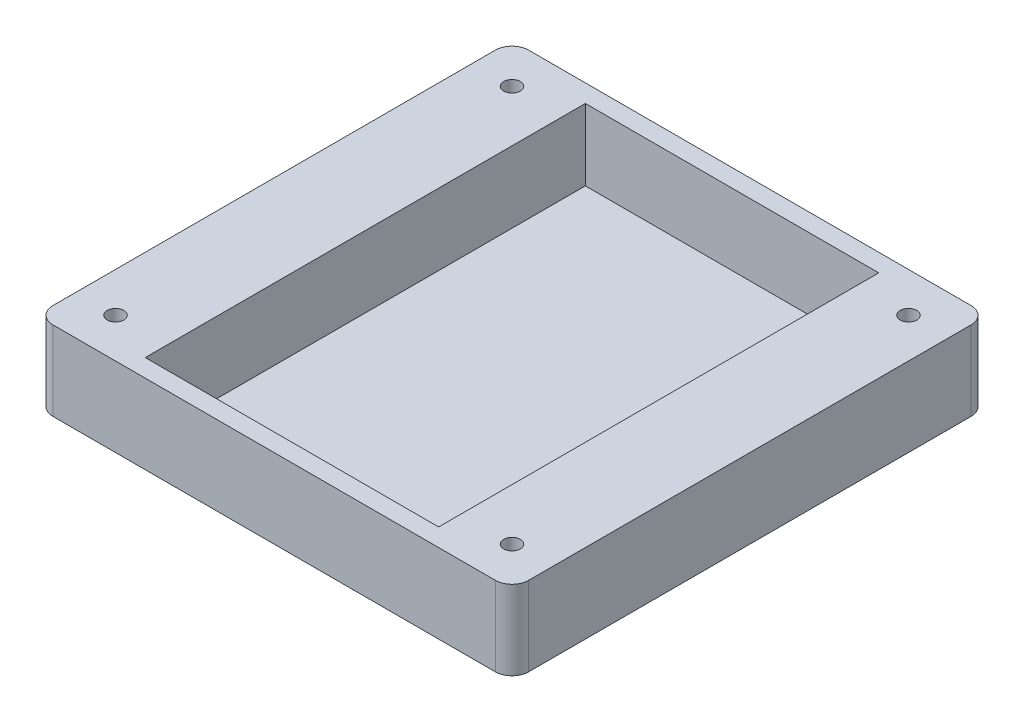
from build123d import *

# Parameters (mm, degrees)
SKETCH1_R           = 2.1
BOSS_EXTRUDE1_DEPTH = 20
SKETCH2_W           = 74
SKETCH2_H           = 111
CUT_EXTRUDE1_DEPTH  = 18


with BuildPart() as part:
    # Sketch1 → Boss-Extrude1 (new body)
    with BuildSketch(Plane(origin=(0, 0, 0), x_dir=(1, 0, 0), z_dir=(0, 1, 0))):
        with BuildLine():
            Line((-55.8, 60), (55.8, 60))
            ThreePointArc((55.8, 60), (58.769848481, 58.769848481), (60, 55.8))
            Line((60, 55.8), (60, -55.8))
            ThreePointArc((60, -55.8), (58.769848481, -58.769848481), (55.8, -60))
            Line((55.8, -60), (-55.8, -60))
            ThreePointArc((-55.8, -60), (-58.769848481, -58.769848481), (-60, -55.8))
            Line((-60, -55.8), (-60, 55.8))
            ThreePointArc((-60, 55.8), (-58.769848481, 58.769848481), (-55.8, 60))
        make_face()
        with Locations(Location((50, 50, 0), (0, 0, 270))):
            Circle(SKETCH1_R, mode=Mode.SUBTRACT)
        with Locations(Location((-50, 50, 0), (0, 0, 90))):
            Circle(SKETCH1_R, mode=Mode.SUBTRACT)
        with Locations(Location((50, -50, 0), (0, 0, 90))):
            Circle(SKETCH1_R, mode=Mode.SUBTRACT)
        with Locations(Location((-50, -50, 0), (0, 0, 270))):
            Circle(SKETCH1_R, mode=Mode.SUBTRACT)
    extrude(amount=BOSS_EXTRUDE1_DEPTH)

    # Sketch2 → Cut-Extrude1 (cut)
    with BuildSketch(Plane(origin=(0, 20, 0), x_dir=(1, 0, 0), z_dir=(0, 1, 0))):
        Rectangle(SKETCH2_W, SKETCH2_H)
    extrude(amount=-CUT_EXTRUDE1_DEPTH, mode=Mode.SUBTRACT)


solid = part.part
